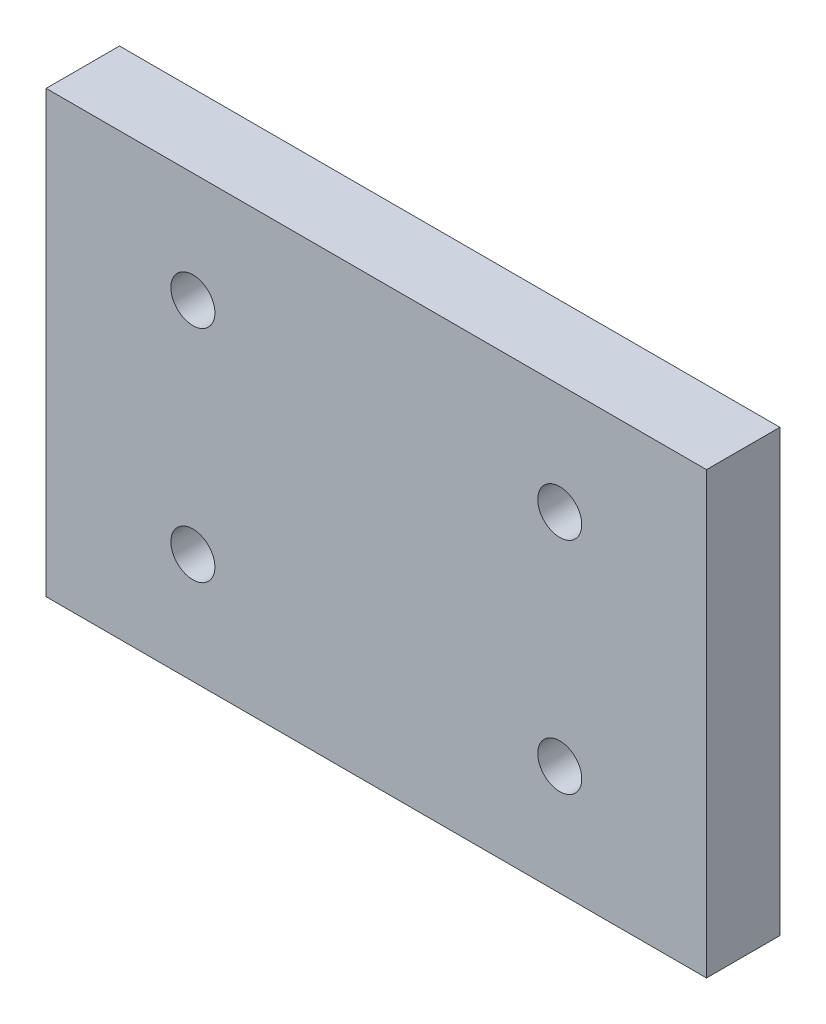
from build123d import *

# Parameters (mm, degrees)
ESBO_O1_W                  = 180
ESBO_O1_H                  = 120
RESSALTO_EXTRUS_O1_DEPTH   = 20
CORTE_EXTRUS_O1_DEPTH      = 152.327459504
CORTE_EXTRUS_O1_DEPTH_BACK = 152.327459504
ESBO_O2_R                  = 6


with BuildPart() as part:
    # Esboço1 → Ressalto-extrusão1 (new body)
    with BuildSketch(Plane.XY):
        with Locations((0, 60)):
            Rectangle(ESBO_O1_W, ESBO_O1_H)
    extrude(amount=RESSALTO_EXTRUS_O1_DEPTH)

    # Esboço2 → Corte-extrusão1 (cut, two sides: drawn at the far end of the back side and taken through both)
    with BuildSketch(Plane(origin=(0, 0, 0), x_dir=(-1, 0, 0), z_dir=(0, 0, -1)).offset(-CORTE_EXTRUS_O1_DEPTH_BACK)):
        with Locations((-50, 90)):
            Circle(ESBO_O2_R)
        with Locations((-50, 30)):
            Circle(ESBO_O2_R)
        with Locations((50, 30)):
            Circle(ESBO_O2_R)
        with Locations((50, 90)):
            Circle(ESBO_O2_R)
    extrude(amount=CORTE_EXTRUS_O1_DEPTH + CORTE_EXTRUS_O1_DEPTH_BACK, mode=Mode.SUBTRACT)


solid = part.part
